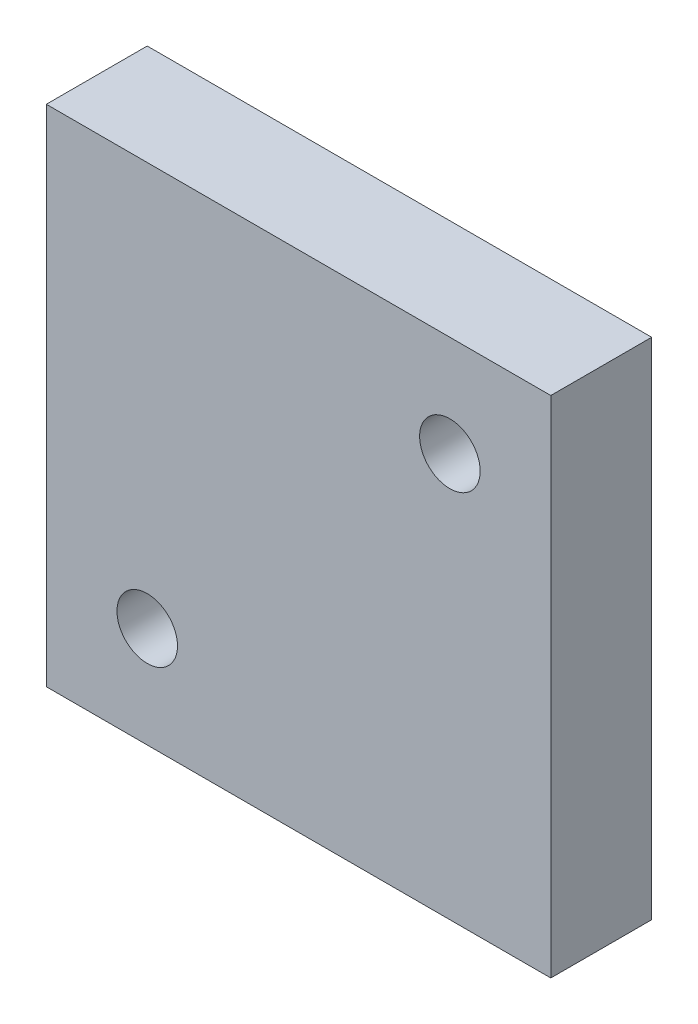
from build123d import *

# Parameters (mm, degrees)
SKETCH1_W                  = 100
SKETCH1_H                  = 100
BOSS_EXTRUDE1_DEPTH        = 20
F_12_0_12_DIAMETER_HOLE1_D = 12


with BuildPart() as part:
    # Sketch1 → Boss-Extrude1 (new body)
    with BuildSketch(Plane.XY):
        with Locations((50, 50)):
            Rectangle(SKETCH1_W, SKETCH1_H)
    extrude(amount=BOSS_EXTRUDE1_DEPTH)

    # Ø12.0 (12) Diameter Hole1 (through all)
    with Locations(Plane.XY.offset(20)):
        with Locations((20, 20), (80, 80)):
            Hole(F_12_0_12_DIAMETER_HOLE1_D / 2)


solid = part.part
